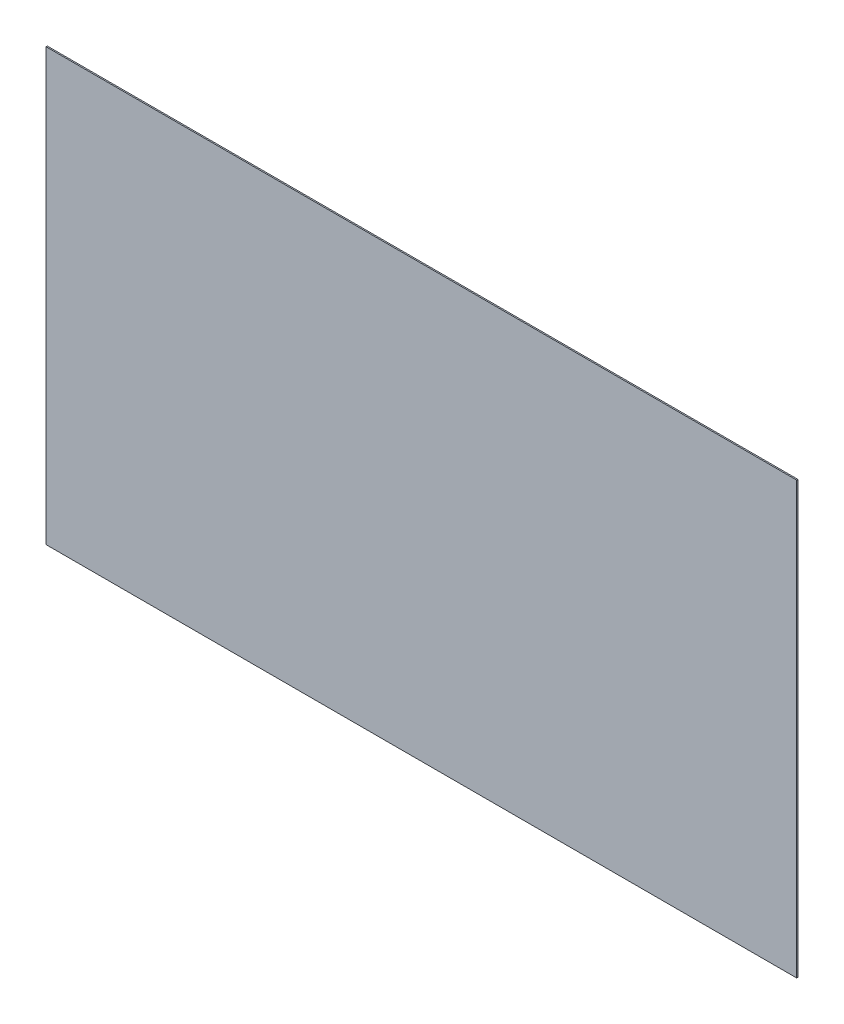
from build123d import *

# Parameters (mm, degrees)
SKETCH2_W           = 596.9
SKETCH2_H           = 342.9
BOSS_EXTRUDE1_DEPTH = 1


with BuildPart() as part:
    # Sketch2 → Boss-Extrude1 (new body)
    with BuildSketch(Plane.XY):
        Rectangle(SKETCH2_W, SKETCH2_H)
    extrude(amount=BOSS_EXTRUDE1_DEPTH)


solid = part.part
